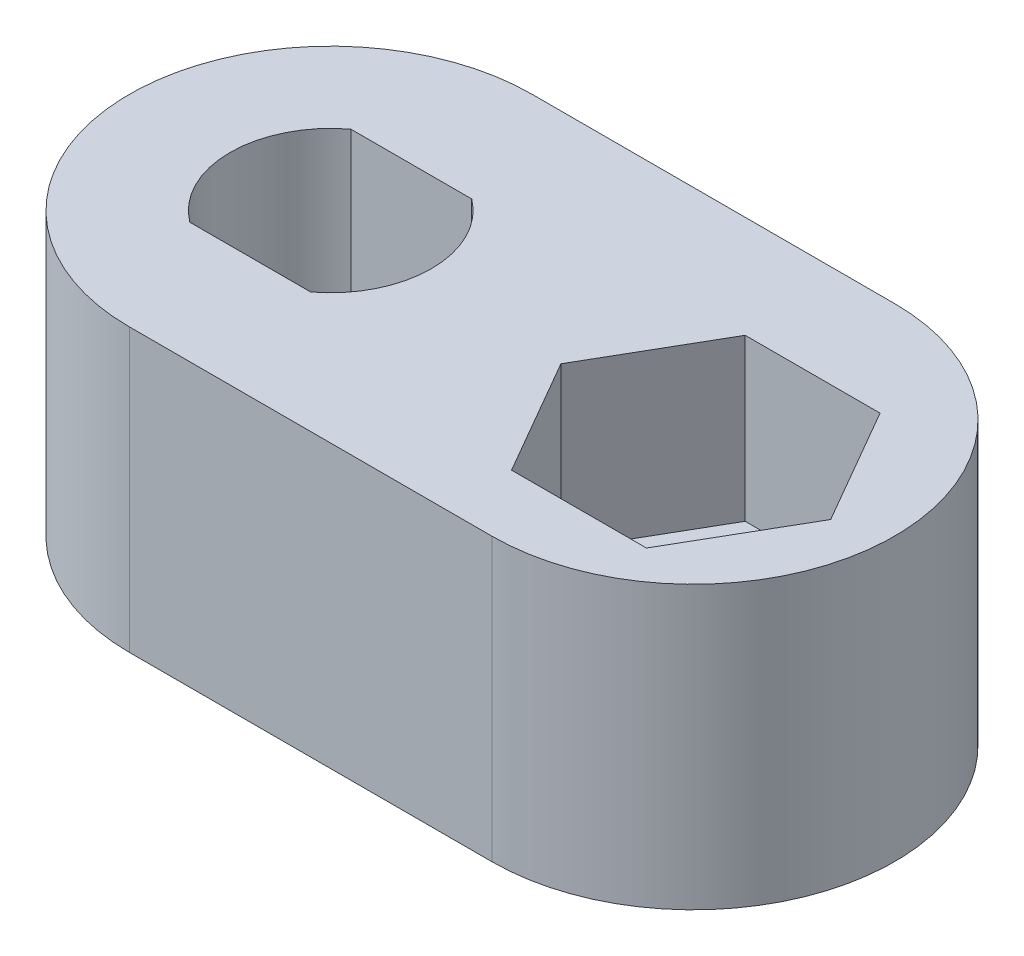
from build123d import *

# Parameters (mm, degrees)
EXTRUDE_1_DEPTH              = 7
CUT_EXTRUDE_1_DEPTH          = 4
HOLE_WIZARD_M3_1_D           = 3.4
HOLE_WIZARD_M3_1_DEPTH       = 7.5
HOLE_WIZARD_M3_1_CSINK_D     = 6.72
HOLE_WIZARD_M3_1_CSINK_ANGLE = 90
HOLE_WIZARD_M3_1_TIP         = 1.021463052
HOLE_WIZARD_1_D              = 4.15
CUT_EXTRUDE_2_DEPTH          = 4


with BuildPart() as part:
    # 草图1 → 凸台-拉伸1 (new body)
    with BuildSketch(Plane(origin=(0, 0, 0), x_dir=(1, 0, 0), z_dir=(0, 1, 0))):
        with BuildLine():
            Line((-4.5, 5), (4.5, 5))
            ThreePointArc((4.5, 5), (9.5, 0), (4.5, -5))
            Line((4.5, -5), (-4.5, -5))
            ThreePointArc((-4.5, -5), (-9.5, 0), (-4.5, 5))
        make_face()
    extrude(amount=EXTRUDE_1_DEPTH)

    # 草图2 → 切除-拉伸1 (cut)
    with BuildSketch(Plane(origin=(0, 7, 0), x_dir=(1, 0, 0), z_dir=(0, 1, 0))):
        with BuildLine():
            Line((-3, 2), (-6, 2))
            ThreePointArc((-6, 2), (-7, 0), (-6, -2))
            Line((-6, -2), (-3, -2))
            ThreePointArc((-3, -2), (-2.263932023, -1.118033989), (-2, 0))
            ThreePointArc((-2, 0), (-2.263932023, 1.118033989), (-3, 2))
        make_face()
    extrude(amount=-CUT_EXTRUDE_1_DEPTH, mode=Mode.SUBTRACT)

    # M3 六角凹锥坑螺钉的锥形沉头孔1
    with Locations(Plane(origin=(0, 0, 0), x_dir=(-1, 0, 0), z_dir=(0, -1, 0))):
        with Locations((4.5, 0)):
            CounterSinkHole(HOLE_WIZARD_M3_1_D / 2, HOLE_WIZARD_M3_1_CSINK_D / 2, depth=HOLE_WIZARD_M3_1_DEPTH, counter_sink_angle=HOLE_WIZARD_M3_1_CSINK_ANGLE)
            with Locations((0, 0, -(HOLE_WIZARD_M3_1_DEPTH + HOLE_WIZARD_M3_1_TIP / 2))):  # 118° drill point
                Cone(0, HOLE_WIZARD_M3_1_D / 2, HOLE_WIZARD_M3_1_TIP, mode=Mode.SUBTRACT)

    # 孔1 (through all)
    with Locations(Plane(origin=(0, 7, 0), x_dir=(1, 0, 0), z_dir=(0, 1, 0))):
        with Locations((5, -0.436816998)):
            Hole(HOLE_WIZARD_1_D / 2)

    # 草图12 → 切除-拉伸2 (cut)
    with BuildSketch(Plane(origin=(0, 7, 0), x_dir=(1, 0, 0), z_dir=(0, 1, 0))):
        Polygon((8.348631561, -0.436816998), (6.674315781, 2.463183002), (3.325684219, 2.463183002), (1.651368439, -0.436816998), (3.325684219, -3.336816998), (6.674315781, -3.336816998), align=None)
    extrude(amount=-CUT_EXTRUDE_2_DEPTH, mode=Mode.SUBTRACT)


solid = part.part
